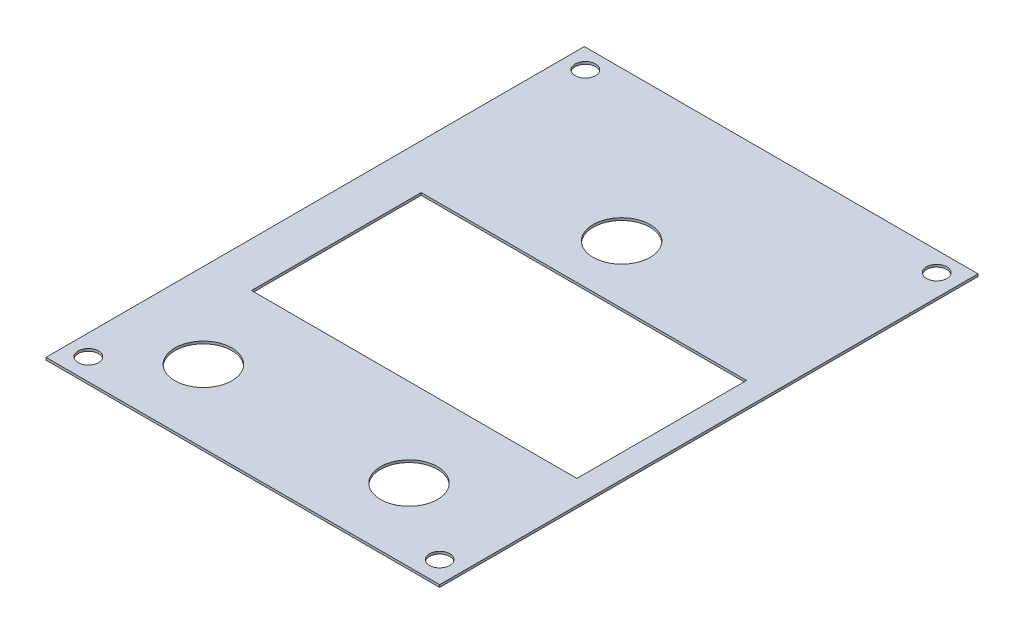
from build123d import *

# Parameters (mm, degrees)
SKETCH1_W           = 48.387
SKETCH1_H           = 66.167
SKETCH1_R           = 1.25
SKETCH1_R_2         = 3.5
SKETCH1_W_2         = 40
SKETCH1_H_2         = 20.859720554
BOSS_EXTRUDE1_DEPTH = 0.3


with BuildPart() as part:
    # Sketch1 → Boss-Extrude1 (new body)
    with BuildSketch(Plane(origin=(0, 0, 0), x_dir=(1, 0, 0), z_dir=(0, 1, 0))):
        with Locations((21.6535, 30.4165)):
            Rectangle(SKETCH1_W, SKETCH1_H)
        with Locations(Location((0, 61.087, 0), (0, 0, 270))):
            Circle(SKETCH1_R, mode=Mode.SUBTRACT)
        with Locations(Location((43.18, 61.087, 0), (0, 0, 270))):
            Circle(SKETCH1_R, mode=Mode.SUBTRACT)
        with Locations(Location((43.18, 0, 0), (0, 0, 270))):
            Circle(SKETCH1_R, mode=Mode.SUBTRACT)
        with Locations(Location((0, 0, 0), (0, 0, 270))):
            Circle(SKETCH1_R, mode=Mode.SUBTRACT)
        with Locations(Location((20.445, 45.103, 0), (0, 0, 270))):
            Circle(SKETCH1_R_2, mode=Mode.SUBTRACT)
        with Locations(Location((33.146, 6.264, 0), (0, 0, 270))):
            Circle(SKETCH1_R_2, mode=Mode.SUBTRACT)
        with Locations(Location((7.873, 6.264, 0), (0, 0, 270))):
            Circle(SKETCH1_R_2, mode=Mode.SUBTRACT)
        with Locations((22.973, 27.503426638)):
            Rectangle(SKETCH1_W_2, SKETCH1_H_2, mode=Mode.SUBTRACT)
    extrude(amount=BOSS_EXTRUDE1_DEPTH)


solid = part.part
